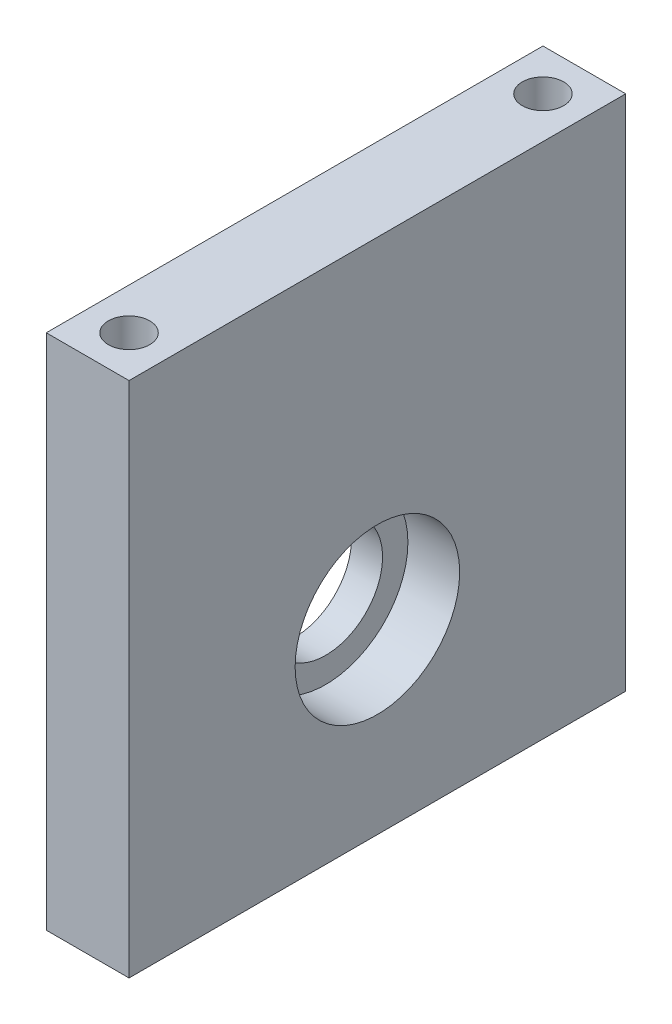
from build123d import *

# Parameters (mm, degrees)
ESQUISSE1_W             = 8
ESQUISSE1_H             = 48
BOSS_EXTRU_1_DEPTH      = 50
ESQUISSE28_R            = 7.95
ENL_V_MAT_EXTRU_1_DEPTH = 10
ESQUISSE29_R            = 8.2
ESQUISSE29_R_2          = 5.5
BOSS_EXTRU_2_DEPTH      = 3
ESQUISSE30_R            = 2
ENL_V_MAT_EXTRU_2_DEPTH = 15
ENL_V_START             = -15
ESQUISSE31_R            = 2
ENL_V_MAT_EXTRU_3_DEPTH = 15


with BuildPart() as part:
    # Esquisse1 → Boss.-Extru.1 (new body)
    with BuildSketch(Plane(origin=(0, 0, 0), x_dir=(1, 0, 0), z_dir=(0, 1, 0))):
        with Locations((4, 24)):
            Rectangle(ESQUISSE1_W, ESQUISSE1_H)
    extrude(amount=BOSS_EXTRU_1_DEPTH)

    # Esquisse28 → Enlèv. mat.-Extru.1 (cut)
    with BuildSketch(Plane(origin=(8, 0, 0), x_dir=(0, 0, -1), z_dir=(1, 0, 0))):
        with Locations((24, 18)):
            Circle(ESQUISSE28_R)
    extrude(amount=-ENL_V_MAT_EXTRU_1_DEPTH, mode=Mode.SUBTRACT)

    # Esquisse29 → Boss.-Extru.2 (add)
    with BuildSketch(Plane.ZY):
        with Locations((-24, 18)):
            Circle(ESQUISSE29_R)
        with Locations((-24, 18)):
            Circle(ESQUISSE29_R_2, mode=Mode.SUBTRACT)
    extrude(amount=-BOSS_EXTRU_2_DEPTH)

    # Esquisse30 → Enlèv. mat.-Extru.2 (cut)
    with BuildSketch(Plane.XZ):
        with Locations((4, -44)):
            Circle(ESQUISSE30_R)
        with Locations((4, -4)):
            Circle(ESQUISSE30_R)
    extrude(amount=-ENL_V_MAT_EXTRU_2_DEPTH, mode=Mode.SUBTRACT)

    # Esquisse31 → Enlèv. mat.-Extru.3 (cut)
    with BuildSketch(Plane(origin=(0, 50, 0), x_dir=(1, 0, 0), z_dir=(0, 1, 0)).offset(ENL_V_START)):
        with Locations((4, 44)):
            Circle(ESQUISSE31_R)
        with Locations((4, 4)):
            Circle(ESQUISSE31_R)
    extrude(amount=ENL_V_MAT_EXTRU_3_DEPTH, mode=Mode.SUBTRACT)


solid = part.part
